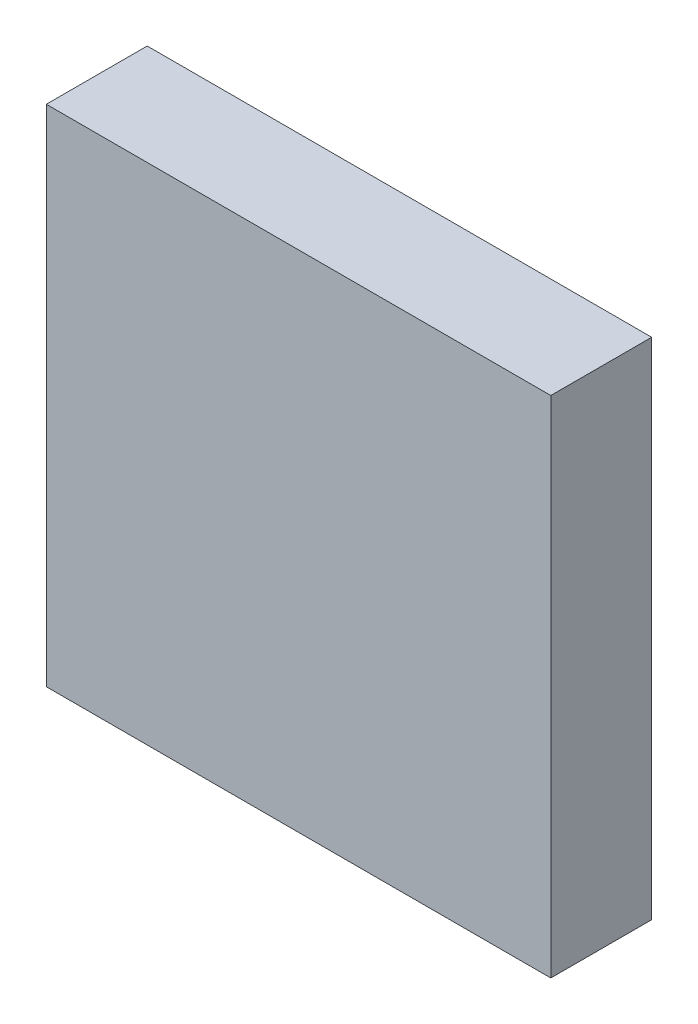
from build123d import *

# Parameters (mm, degrees)
SKETCH1_W           = 0.5
SKETCH1_H           = 0.5
BOSS_EXTRUDE1_DEPTH = 0.1


with BuildPart() as part:
    # Sketch1 → Boss-Extrude1 (new body)
    with BuildSketch(Plane.XY):
        with Locations((0.25, 0.25)):
            Rectangle(SKETCH1_W, SKETCH1_H)
    extrude(amount=BOSS_EXTRUDE1_DEPTH)


solid = part.part
